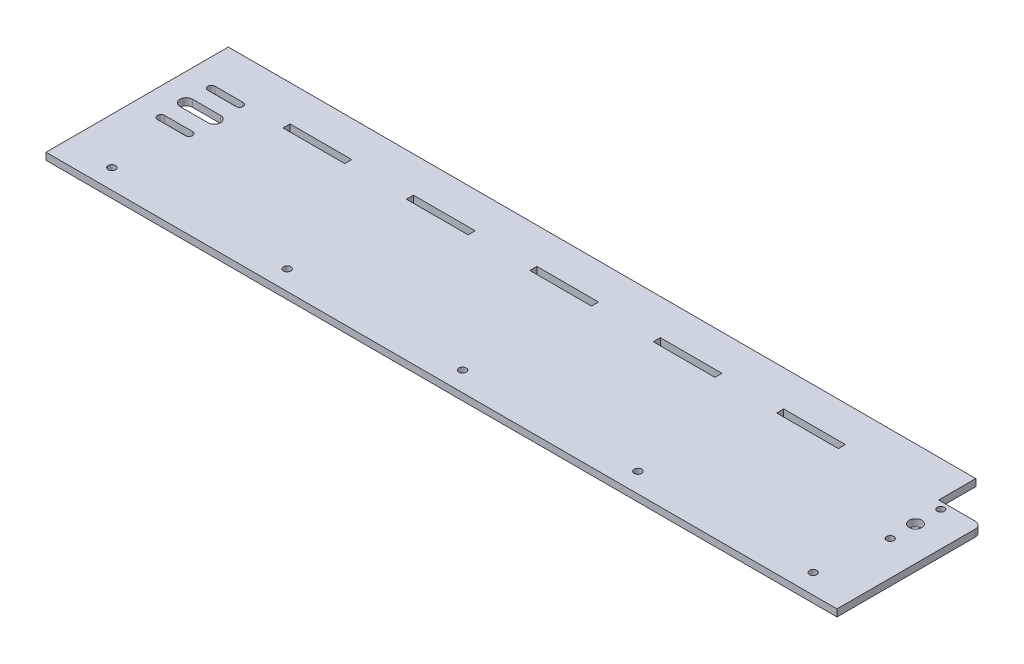
from build123d import *

# Parameters (mm, degrees)
SKETCH1_R           = 2.55
SKETCH1_R_2         = 4.5
SKETCH1_R_3         = 2.65
SKETCH1_W           = 44
SKETCH1_H           = 5
BOSS_EXTRUDE1_DEPTH = 5


with BuildPart() as part:
    # Sketch1 → Boss-Extrude1 (new body)
    with BuildSketch(Plane(origin=(0, 0, 0), x_dir=(1, 0, 0), z_dir=(0, 1, 0))):
        with BuildLine():
            Line((0, 0), (0, 33.5))
            ThreePointArc((0, 33.5), (-1.464466094, 37.035533906), (-5, 38.5))
            Line((-5, 38.5), (-31, 38.5))
            Line((-31, 38.5), (-31, 65))
            Line((-31, 65), (-564, 65))
            Line((-564, 65), (-564, -65))
            Line((-564, -65), (-524.5, -65))
            Line((-524.5, -65), (0, -65))
            Line((0, -65), (0, 0))
        make_face()
        with Locations(Location((-24.5, 33.5, 0), (0, 0, 270))):
            Circle(SKETCH1_R, mode=Mode.SUBTRACT)
        with Locations(Location((-24.5, -2.5, 0), (0, 0, 270))):
            Circle(SKETCH1_R, mode=Mode.SUBTRACT)
        with Locations(Location((-24.5, 15.5, 0), (0, 0, 270))):
            Circle(SKETCH1_R_2, mode=Mode.SUBTRACT)
        with Locations(Location((-531, -51, 0), (0, 0, 270))):
            Circle(SKETCH1_R_3, mode=Mode.SUBTRACT)
        with Locations(Location((-406, -51, 0), (0, 0, 270))):
            Circle(SKETCH1_R_3, mode=Mode.SUBTRACT)
        with Locations(Location((-281, -51, 0), (0, 0, 270))):
            Circle(SKETCH1_R_3, mode=Mode.SUBTRACT)
        with Locations(Location((-156, -51, 0), (0, 0, 270))):
            Circle(SKETCH1_R_3, mode=Mode.SUBTRACT)
        with Locations(Location((-31, -51, 0), (0, 0, 270))):
            Circle(SKETCH1_R_3, mode=Mode.SUBTRACT)
        with Locations((-472.510496642, 37)):
            Rectangle(SKETCH1_W, SKETCH1_H, mode=Mode.SUBTRACT)
        with Locations((-384.510496642, 37)):
            Rectangle(SKETCH1_W, SKETCH1_H, mode=Mode.SUBTRACT)
        with BuildLine():
            Line((-544.5, 36.05), (-524.5, 36.05))
            ThreePointArc((-524.5, 36.05), (-521.95, 33.5), (-524.5, 30.95))
            Line((-524.5, 30.95), (-544.5, 30.95))
            ThreePointArc((-544.5, 30.95), (-547.05, 33.5), (-544.5, 36.05))
        make_face(mode=Mode.SUBTRACT)
        with BuildLine():
            Line((-524.5, 0.05), (-544.5, 0.05))
            ThreePointArc((-544.5, 0.05), (-547.05, -2.5), (-544.5, -5.05))
            Line((-544.5, -5.05), (-524.5, -5.05))
            ThreePointArc((-524.5, -5.05), (-521.95, -2.5), (-524.5, 0.05))
        make_face(mode=Mode.SUBTRACT)
        with Locations((-296.510496642, 37)):
            Rectangle(SKETCH1_W, SKETCH1_H, mode=Mode.SUBTRACT)
        with BuildLine():
            Line((-544.5, 20), (-524.5, 20))
            ThreePointArc((-524.5, 20), (-520, 15.5), (-524.5, 11))
            Line((-524.5, 11), (-544.5, 11))
            ThreePointArc((-544.5, 11), (-549, 15.5), (-544.5, 20))
        make_face(mode=Mode.SUBTRACT)
        with Locations((-208.510496642, 37)):
            Rectangle(SKETCH1_W, SKETCH1_H, mode=Mode.SUBTRACT)
        with Locations((-120.510496642, 37)):
            Rectangle(SKETCH1_W, SKETCH1_H, mode=Mode.SUBTRACT)
    extrude(amount=BOSS_EXTRUDE1_DEPTH)


solid = part.part
